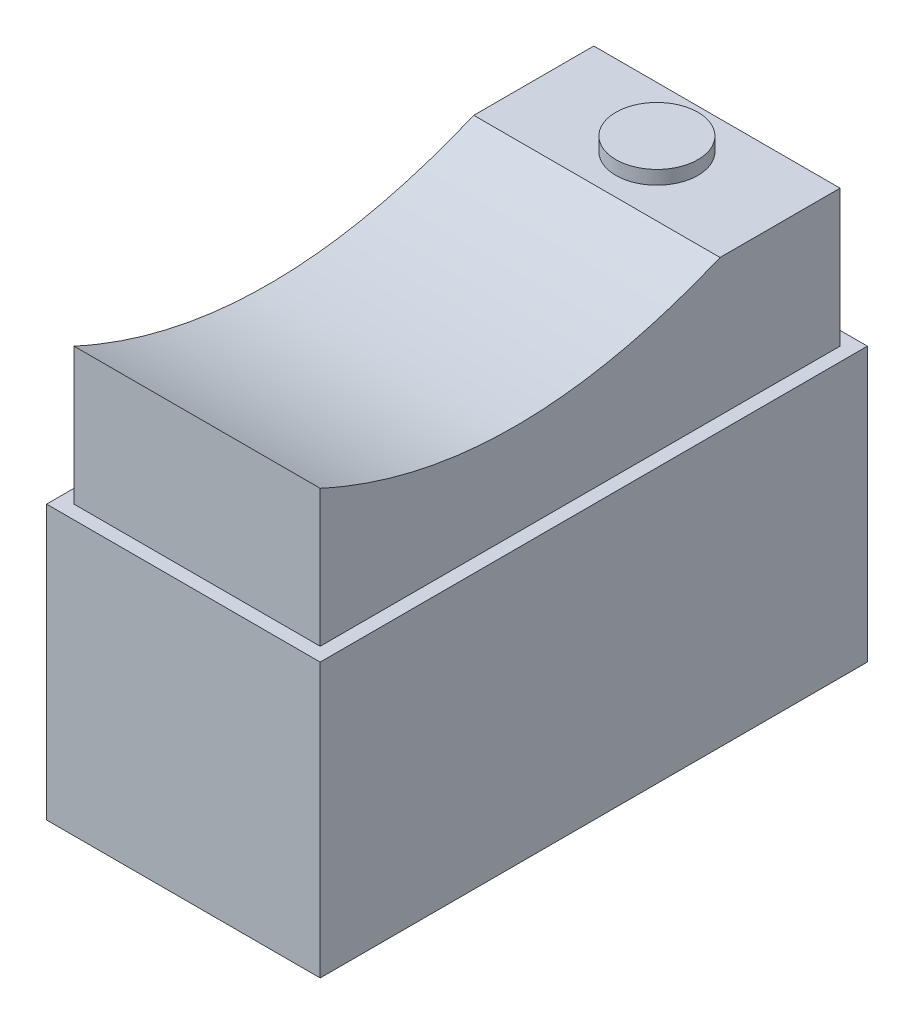
from build123d import *

# Parameters (mm, degrees)
CROQUIS1_W                 = 20
CROQUIS1_H                 = 40
SALIENTE_EXTRUIR1_DEPTH    = 30
CROQUIS2_W                 = 20
CROQUIS2_H                 = 40
CROQUIS2_W_2               = 18
CROQUIS2_H_2               = 38
CORTAR_EXTRUIR1_DEPTH      = 10
CORTAR_EXTRUIR2_DEPTH      = 41.755367745
CORTAR_EXTRUIR2_DEPTH_BACK = 41.755367745
CROQUIS4_R                 = 3
SALIENTE_EXTRUIR2_DEPTH    = 1


with BuildPart() as part:
    # Croquis1 → Saliente-Extruir1 (new body)
    with BuildSketch(Plane(origin=(0, 0, 0), x_dir=(1, 0, 0), z_dir=(0, 1, 0))):
        Rectangle(CROQUIS1_W, CROQUIS1_H)
    extrude(amount=SALIENTE_EXTRUIR1_DEPTH)

    # Croquis2 → Cortar-Extruir1 (cut)
    with BuildSketch(Plane(origin=(0, 30, 0), x_dir=(1, 0, 0), z_dir=(0, 1, 0))):
        Rectangle(CROQUIS2_W, CROQUIS2_H)
        Rectangle(CROQUIS2_W_2, CROQUIS2_H_2, mode=Mode.SUBTRACT)
    extrude(amount=-CORTAR_EXTRUIR1_DEPTH, mode=Mode.SUBTRACT)

    # Croquis3 → Cortar-Extruir2 (cut, two sides: drawn at the far end of the back side and taken through both)
    with BuildSketch(Plane.ZY.offset(9).offset(-CORTAR_EXTRUIR2_DEPTH_BACK)):
        with BuildLine():
            Line((19, 30), (-10.226390802, 30))
            add(Edge.make_bspline(
                [(-10.226390802, 30), (5.11136514, 23.592400747), (19, 30)],
                knots=[0, 0, 0, 1, 1, 1], degree=2))
        make_face()
    extrude(amount=CORTAR_EXTRUIR2_DEPTH + CORTAR_EXTRUIR2_DEPTH_BACK, mode=Mode.SUBTRACT)

    # Croquis4 → Saliente-Extruir2 (add)
    with BuildSketch(Plane(origin=(0, 30, 0), x_dir=(1, 0, 0), z_dir=(0, 1, 0))):
        with Locations(Location((0, 14.613195401, 0), (0, 0, 90))):
            Circle(CROQUIS4_R)
    extrude(amount=SALIENTE_EXTRUIR2_DEPTH)


solid = part.part
